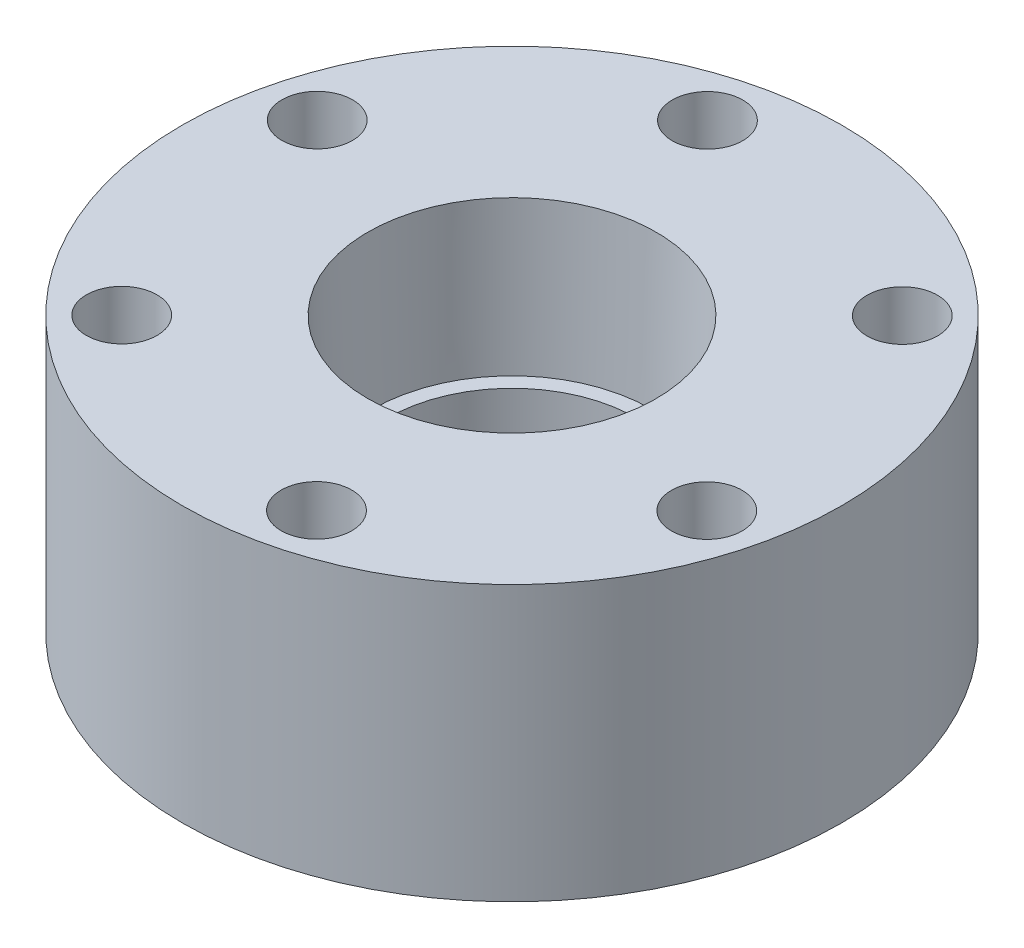
from build123d import *

# Parameters (mm, degrees)
SKETCH1_R               = 30.48
BOSS_EXTRUDE1_DEPTH     = 25.4
SKETCH2_R               = 20.6502
CUT_EXTRUDE1_DEPTH      = 6.35
F_1_4_CLEARANCE_HOLE1_D = 6.5278


with BuildPart() as part:
    # Sketch1 → Boss-Extrude1 (new body)
    with BuildSketch(Plane(origin=(0, 0, 0), x_dir=(1, 0, 0), z_dir=(0, 1, 0))):
        with Locations(Location((0, 0, 0), (0, 0, 270))):
            Circle(SKETCH1_R)
    extrude(amount=BOSS_EXTRUDE1_DEPTH)

    # Sketch2 → Cut-Extrude1 (cut)
    with BuildSketch(Plane.XZ):
        with Locations(Location((0, 0, 0), (0, 0, 270))):
            Circle(SKETCH2_R)
    extrude(amount=-CUT_EXTRUDE1_DEPTH, mode=Mode.SUBTRACT)

    # Sketch4 → 3/4 NPT Tapped Hole1 (revolve, cut)
    with BuildSketch(Plane(origin=(0, 25.4, 0), x_dir=(0, 0, 1), z_dir=(1, 0, 0))):
        Polygon((0, 0), (0, 25.4), (11.5062, 25.4), (11.5062, 13.97), (12.914204892, 13.97), (13.3324854, 0), align=None)
    revolve(axis=Axis((0, 31.75, 0), (0, -1, 0)), mode=Mode.SUBTRACT)

    # 1/4 Clearance Hole1 (through all)
    with Locations(Plane(origin=(0, 25.4, 0), x_dir=(1, 0, 0), z_dir=(0, 1, 0))):
        with Locations((-24.636533331, 6.627886666), (-18.058184892, -18.021920393), (6.578348439, -24.649807059), (24.636533331, -6.627886666), (18.058184892, 18.021920393), (-6.578348439, 24.649807059)):
            Hole(F_1_4_CLEARANCE_HOLE1_D / 2)


solid = part.part
